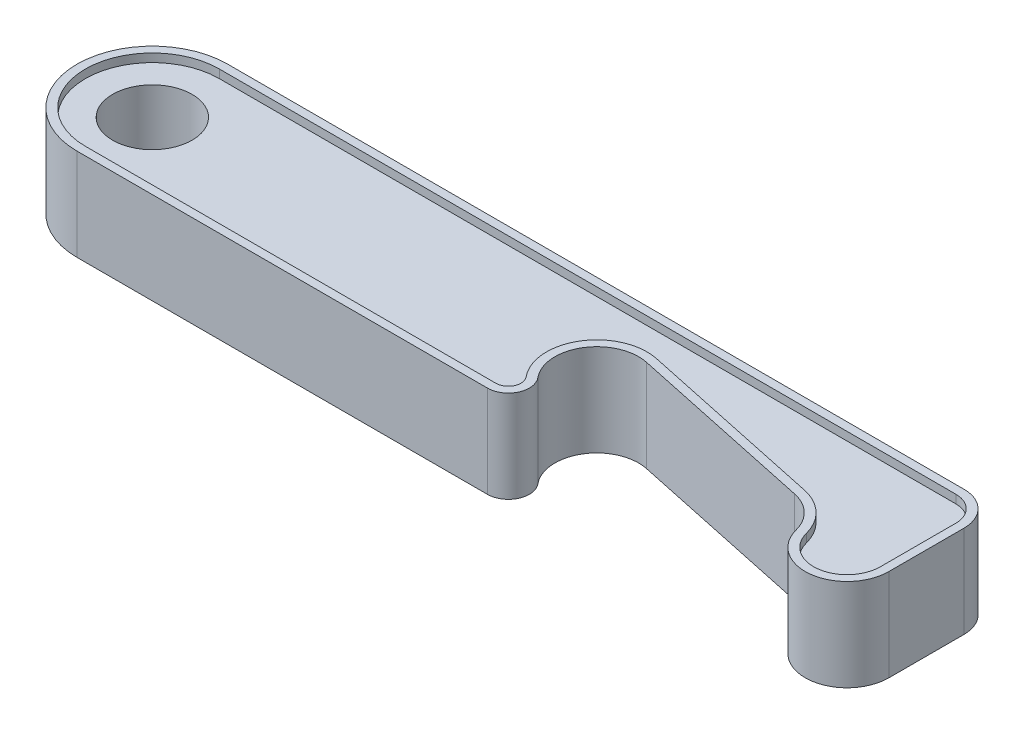
from build123d import *

# Parameters (mm, degrees)
SKETCH2_R           = 4.75
BOSS_EXTRUDE1_DEPTH = 4.5
BOSS_EXTRUDE2_DEPTH = 5.5


with BuildPart() as part:
    # Sketch2 → Boss-Extrude1 (new, symmetric)
    with BuildSketch(Plane(origin=(0, 0, 0), x_dir=(1, 0, 0), z_dir=(0, 1, 0))):
        with BuildLine():
            Line((88, 8), (0, 8))
            ThreePointArc((0, 8), (-8, 0), (0, -8))
            Line((0, -8), (49.040217235, -8))
            ThreePointArc((49.040217235, -8), (50.397559636, -7.138452508), (50.195682115, -5.543495472))
            ThreePointArc((50.195682115, -5.543495472), (49.68486052, 1.389866291), (56.065011779, 4.151408242))
            Line((56.065011779, 4.151408242), (78.565011779, -0.631114396))
            ThreePointArc((78.565011779, -0.631114396), (81.467470443, -2.166630539), (83.127016654, -5))
            ThreePointArc((83.127016654, -5), (87.50401717, -7.968118785), (91, -4))
            Line((91, -4), (91, 5))
            ThreePointArc((91, 5), (90.121320344, 7.121320344), (88, 8))
        make_face()
        Circle(SKETCH2_R, mode=Mode.SUBTRACT)
    extrude(amount=BOSS_EXTRUDE1_DEPTH, both=True)

    # Sketch2<3> → Boss-Extrude2 (add, symmetric)
    with BuildSketch(Plane(origin=(0, 0, 0), x_dir=(1, 0, 0), z_dir=(0, 1, 0))):
        with BuildLine():
            Line((88, 9), (0, 9))
            ThreePointArc((0, 9), (-9, 0), (0, -9))
            Line((0, -9), (49.040217235, -9))
            ThreePointArc((49.040217235, -9), (51.302454571, -7.564087513), (50.965992035, -4.905825787))
            ThreePointArc((50.965992035, -4.905825787), (50.540307373, 0.871975682), (55.857100089, 3.173260641))
            Line((55.857100089, 3.173260641), (78.357100089, -1.609261996))
            ThreePointArc((78.357100089, -1.609261996), (80.775815642, -2.888858783), (82.158770817, -5.25))
            ThreePointArc((82.158770817, -5.25), (87.630021462, -8.960148481), (92, -4))
            Line((92, -4), (92, 5))
            ThreePointArc((92, 5), (90.828427125, 7.828427125), (88, 9))
        make_face()
        with BuildLine():
            ThreePointArc((0, -8), (-8, 0), (0, 8))
            Line((0, 8), (88, 8))
            ThreePointArc((88, 8), (90.121320344, 7.121320344), (91, 5))
            Line((91, 5), (91, -4))
            ThreePointArc((91, -4), (87.50401717, -7.968118785), (83.127016654, -5))
            ThreePointArc((83.127016654, -5), (81.467470443, -2.166630539), (78.565011779, -0.631114396))
            Line((78.565011779, -0.631114396), (56.065011779, 4.151408242))
            ThreePointArc((56.065011779, 4.151408242), (49.68486052, 1.389866291), (50.195682115, -5.543495472))
            ThreePointArc((50.195682115, -5.543495472), (50.397559636, -7.138452508), (49.040217235, -8))
            Line((49.040217235, -8), (0, -8))
        make_face(mode=Mode.SUBTRACT)
    extrude(amount=BOSS_EXTRUDE2_DEPTH, both=True)


solid = part.part
